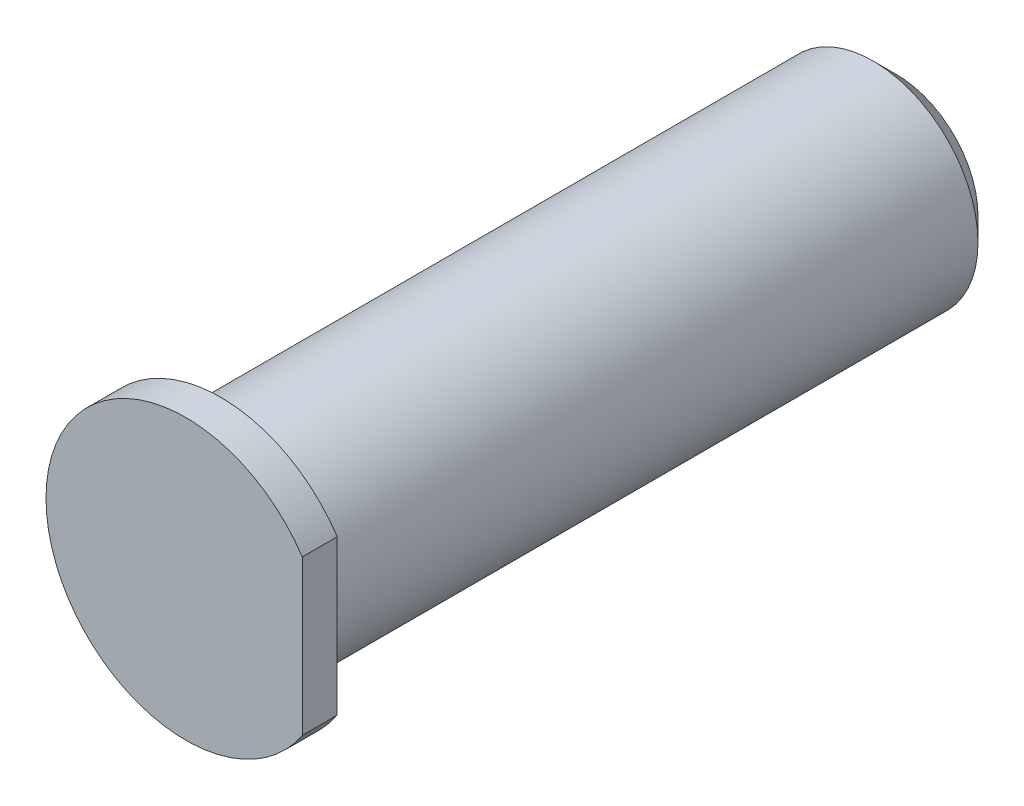
from build123d import *

# Parameters (mm, degrees)
ESQUISSE_CYLINDRE_R = 4.5
CYLINDRE_DEPTH      = 29
EPAULEMENT_DEPTH    = 1.5
ESQUISSE_TROU_R     = 2
TROU_DEPTH          = 3.5
CHANFREIN1_SIZE     = 1


with BuildPart() as part:
    # Esquisse_cylindre → Cylindre (new body)
    with BuildSketch(Plane.XY):
        Circle(ESQUISSE_CYLINDRE_R)
    extrude(amount=-CYLINDRE_DEPTH)

    # Esquisse_épaulement → Epaulement (add)
    with BuildSketch(Plane.XY):
        with BuildLine():
            Line((5, 3.31662479), (5, -3.31662479))
            ThreePointArc((5, -3.31662479), (-6, 0), (5, 3.31662479))
        make_face()
    extrude(amount=EPAULEMENT_DEPTH)

    # Esquisse_trou → Trou (cut)
    with BuildSketch(Plane(origin=(0, 0, -29), x_dir=(-1, 0, 0), z_dir=(0, 0, -1))):
        Circle(ESQUISSE_TROU_R)
    extrude(amount=-TROU_DEPTH, mode=Mode.SUBTRACT)

    # Chanfrein1
    chanfrein1_edges = [part.edges().sort_by_distance(p)[0] for p in [
        (-4.5, 0, -29),
    ]]
    chamfer(chanfrein1_edges, length=CHANFREIN1_SIZE)


solid = part.part
